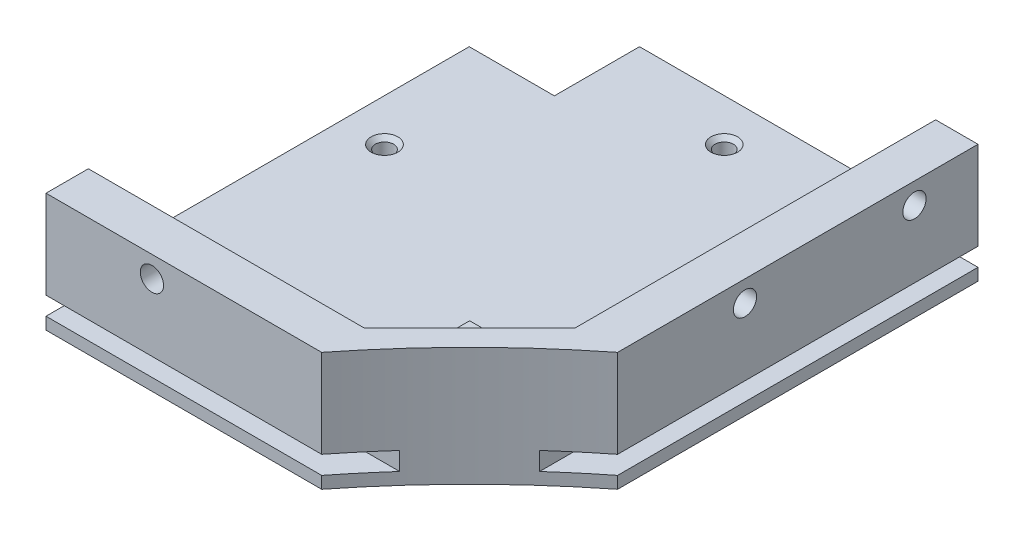
from build123d import *

# Parameters (mm, degrees)
SKETCH1_W                = 650
SKETCH1_H                = 650
BOSS_EXTRUDE1_DEPTH      = 8
BOSS_EXTRUDE2_DEPTH      = 650
CUT_EXTRUDE2_DEPTH       = 921.277302922
CUT_EXTRUDE2_DEPTH_BACK  = 921.277302922
SKETCH4_R                = 11
CUT_EXTRUDE1_DEPTH       = 920.932062709
CUT_EXTRUDE1_DEPTH_BACK  = 920.932062709
SKETCH2_R                = 210
CUT_EXTRUDE3_DEPTH       = 921.277302998
CUT_EXTRUDE3_DEPTH_BACK  = 110
CUT_EXTRUDE4_DEPTH       = 110
CUT_EXTRUDE5_DEPTH       = 920.932062713
CUT_EXTRUDE5_DEPTH_BACK  = 920.932062713
SKETCH7_OUTSIDE_W        = 836.056
SKETCH7_OUTSIDE_H        = 836.056
BOSS_EXTRUDE3_DEPTH      = 160.08
BOSS_EXTRUDE4_DEPTH      = 160.08
SKETCH21_W               = 10
SKETCH21_H               = 4.3
CUT_EXTRUDE10_DEPTH      = 680.197320372
SKETCH22_W               = 10
SKETCH22_H               = 4.3
CUT_EXTRUDE11_DEPTH      = 278.189465889
BOSS_EXTRUDE5_DEPTH      = 60
CUT_EXTRUDE6_DEPTH       = 679.914574891
CUT_EXTRUDE6_DEPTH_BACK  = 679.914574891
SKETCH12_R               = 210
CUT_EXTRUDE14_DEPTH      = 11
SKETCH27_R               = 2.2
SKETCH27_R_2             = 2.75
CUT_EXTRUDE15_DEPTH      = 11
SKETCH28_R               = 2.75
SKETCH28_R_2             = 2.2
CUT_EXTRUDE16_DEPTH      = 11
SKETCH29_W               = 20
SKETCH29_H               = 20
CUT_EXTRUDE17_DEPTH      = 10
CUT_EXTRUDE18_DEPTH      = 679.914574891
CUT_EXTRUDE18_DEPTH_BACK = 679.914574891
SKETCH30_W               = 95
SKETCH30_H               = 195
CUT_EXTRUDE19_DEPTH      = 679.914574891
CUT_EXTRUDE19_DEPTH_BACK = 679.914574891
SKETCH31_W               = 100
SKETCH31_H               = 75
SKETCH32_W               = 20.1
SKETCH32_H               = 20.1
CUT_EXTRUDE20_DEPTH      = 10
SKETCH33_R               = 2.15
CUT_EXTRUDE21_DEPTH      = 10
CHAMFER1_SIZE            = 1


with BuildPart() as part:
    # Sketch1 → Boss-Extrude1 (new body)
    with BuildSketch(Plane(origin=(0, 0, 0), x_dir=(1, 0, 0), z_dir=(0, 1, 0))):
        with Locations((325, 325)):
            Rectangle(SKETCH1_W, SKETCH1_H)
    extrude(amount=BOSS_EXTRUDE1_DEPTH)

    # Sketch3 → Boss-Extrude2 (add)
    with BuildSketch(Plane.XY):
        Polygon((300, 43.707142143), (350, 43.707142143), (385, 8), (265, 8), align=None)
    extrude(amount=-BOSS_EXTRUDE2_DEPTH)

    # Sketch4 → Cut-Extrude2 (cut, two sides: drawn at the far end of the back side and taken through both)
    with BuildSketch(Plane.XY.offset(-CUT_EXTRUDE2_DEPTH_BACK)):
        with Locations((325, 22)):
            Circle(SKETCH4_R)
    extrude(amount=CUT_EXTRUDE2_DEPTH + CUT_EXTRUDE2_DEPTH_BACK, mode=Mode.SUBTRACT)

    # Sketch2 → Cut-Extrude1 (cut, two sides: drawn at the far end of the back side and taken through both)
    with BuildSketch(Plane(origin=(0, 8, 0), x_dir=(1, 0, 0), z_dir=(0, 1, 0)).offset(-CUT_EXTRUDE1_DEPTH_BACK)):
        with Locations(Location((325, 325, 0), (0, 0, 270))):
            Circle(SKETCH2_R)
    extrude(amount=CUT_EXTRUDE1_DEPTH + CUT_EXTRUDE1_DEPTH_BACK, mode=Mode.SUBTRACT)

    # Sketch5 → Cut-Extrude3 (cut, two sides: drawn at the far end of the back side and taken through both)
    with BuildSketch(Plane.XY.offset(-CUT_EXTRUDE3_DEPTH_BACK)):
        Polygon((300, 43.707142143), (350, 43.707142143), (365.396078824, 28), (350, 28), (350, 8), (300, 8), (300, 28), (284.603921176, 28), align=None)
    extrude(amount=CUT_EXTRUDE3_DEPTH + CUT_EXTRUDE3_DEPTH_BACK, mode=Mode.SUBTRACT)

    # Sketch6 → Cut-Extrude4 (cut)
    with BuildSketch(Plane(origin=(0, 0, -650), x_dir=(-1, 0, 0), z_dir=(0, 0, -1))):
        Polygon((-350, 43.707142143), (-300, 43.707142143), (-284.603921176, 28), (-300, 28), (-300, 8), (-350, 8), (-350, 28), (-365.396078824, 28), align=None)
    extrude(amount=-CUT_EXTRUDE4_DEPTH, mode=Mode.SUBTRACT)

    # Sketch7 outside → Cut-Extrude5 (cut, two sides: drawn at the far end of the back side and taken through both)
    with BuildSketch(Plane(origin=(0, 8, 0), x_dir=(1, 0, 0), z_dir=(0, 1, 0)).offset(-CUT_EXTRUDE5_DEPTH_BACK)):
        with Locations((325, 325)):
            Rectangle(SKETCH7_OUTSIDE_W, SKETCH7_OUTSIDE_H)
        Polygon((195, 455), (195, 489.924225025), (195, 650), (167.478198198, 686.544504505), (-70.838918919, 686.544504505), (-70.838918919, 472.462112512), (0, 455), (160.075774975, 455), align=None, mode=Mode.SUBTRACT)
    extrude(amount=CUT_EXTRUDE5_DEPTH + CUT_EXTRUDE5_DEPTH_BACK, mode=Mode.SUBTRACT)

    # Sketch8 → Boss-Extrude3 (add)
    with BuildSketch(Plane(origin=(0, 0, -650), x_dir=(-1, 0, 0), z_dir=(0, 0, -1))):
        Polygon((-195, 8), (-195, 28), (-185, 28), (-185, 17), (-175, 8), align=None)
    extrude(amount=-BOSS_EXTRUDE3_DEPTH)

    # Sketch10 → Boss-Extrude4 (add)
    with BuildSketch(Plane.ZY):
        Polygon((-455, 8), (-455, 28), (-465, 28), (-465, 17), (-475, 8), align=None)
    extrude(amount=-BOSS_EXTRUDE4_DEPTH)

    # Sketch21 → Cut-Extrude10 (cut, through all)
    with BuildSketch(Plane.ZY):
        with Locations((-460, 5)):
            Rectangle(SKETCH21_W, SKETCH21_H)
    extrude(amount=-CUT_EXTRUDE10_DEPTH, mode=Mode.SUBTRACT)

    # Sketch22 → Cut-Extrude11 (cut, through all)
    with BuildSketch(Plane(origin=(0, 0, -650), x_dir=(-1, 0, 0), z_dir=(0, 0, -1))):
        with Locations((-190, 5)):
            Rectangle(SKETCH22_W, SKETCH22_H)
    extrude(amount=-CUT_EXTRUDE11_DEPTH, mode=Mode.SUBTRACT)

    # Sketch23 → Boss-Extrude5 (add)
    with BuildSketch(Plane.XY.offset(-489.92)):
        Polygon((194.99464011, 8), (195, 28), (160.08, 28), (160.08, 8), align=None)
    extrude(amount=BOSS_EXTRUDE5_DEPTH)

    # Sketch12 → Cut-Extrude6 (cut, two sides: drawn at the far end of the back side and taken through both)
    with BuildSketch(Plane(origin=(0, 8, 0), x_dir=(1, 0, 0), z_dir=(0, 1, 0)).offset(-CUT_EXTRUDE6_DEPTH_BACK)):
        with Locations((325, 325)):
            Circle(SKETCH12_R)
    extrude(amount=CUT_EXTRUDE6_DEPTH + CUT_EXTRUDE6_DEPTH_BACK, mode=Mode.SUBTRACT)

    # Sketch26 → Cut-Extrude14 (cut)
    with BuildSketch(Plane(origin=(0, 28, 0), x_dir=(1, 0, 0), z_dir=(0, 1, 0))):
        Polygon((185, 489.92), (160.08, 489.92), (160.08, 465), align=None)
    extrude(amount=-CUT_EXTRUDE14_DEPTH, mode=Mode.SUBTRACT)

    # Sketch27 → Cut-Extrude15 (cut)
    with BuildSketch(Plane.ZY.offset(-185)):
        with Locations((-610, 23)):
            Circle(SKETCH27_R)
        with Locations((-560, 23)):
            Circle(SKETCH27_R_2)
        with Locations((-520, 23)):
            Circle(SKETCH27_R_2)
    extrude(amount=-CUT_EXTRUDE15_DEPTH, mode=Mode.SUBTRACT)

    # Sketch28 → Cut-Extrude16 (cut)
    with BuildSketch(Plane(origin=(0, 0, -465), x_dir=(-1, 0, 0), z_dir=(0, 0, -1))):
        with Locations((-120, 23)):
            Circle(SKETCH28_R)
        with Locations((-80, 23)):
            Circle(SKETCH28_R_2)
        with Locations((-40, 23)):
            Circle(SKETCH28_R_2)
    extrude(amount=-CUT_EXTRUDE16_DEPTH, mode=Mode.SUBTRACT)

    # Sketch29 → Cut-Extrude17 (cut)
    with BuildSketch(Plane(origin=(0, 8, 0), x_dir=(1, 0, 0), z_dir=(0, 1, 0))):
        with Locations((10, 640)):
            Rectangle(SKETCH29_W, SKETCH29_H)
    extrude(amount=-CUT_EXTRUDE17_DEPTH, mode=Mode.SUBTRACT)

    # Sketch30 → Cut-Extrude18 (cut, two sides: drawn at the far end of the back side and taken through both)
    with BuildSketch(Plane(origin=(0, 8, 0), x_dir=(1, 0, 0), z_dir=(0, 1, 0)).offset(-CUT_EXTRUDE18_DEPTH_BACK)):
        with Locations((47.5, 552.5)):
            Rectangle(SKETCH30_W, SKETCH30_H)
    extrude(amount=CUT_EXTRUDE18_DEPTH + CUT_EXTRUDE18_DEPTH_BACK, mode=Mode.SUBTRACT)

    # Sketch31 → Cut-Extrude19 (cut, two sides: drawn at the far end of the back side and taken through both)
    with BuildSketch(Plane(origin=(0, 8, 0), x_dir=(1, 0, 0), z_dir=(0, 1, 0)).offset(-CUT_EXTRUDE19_DEPTH_BACK)):
        with Locations((145, 612.5)):
            Rectangle(SKETCH31_W, SKETCH31_H)
    extrude(amount=CUT_EXTRUDE19_DEPTH + CUT_EXTRUDE19_DEPTH_BACK, mode=Mode.SUBTRACT)

    # Sketch32 → Cut-Extrude20 (cut)
    with BuildSketch(Plane(origin=(0, 8, 0), x_dir=(1, 0, 0), z_dir=(0, 1, 0))):
        with Locations((105.05, 564.95)):
            Rectangle(SKETCH32_W, SKETCH32_H)
    extrude(amount=-CUT_EXTRUDE20_DEPTH, mode=Mode.SUBTRACT)

    # Sketch33 → Cut-Extrude21 (cut)
    with BuildSketch(Plane(origin=(0, 8, 0), x_dir=(1, 0, 0), z_dir=(0, 1, 0))):
        with Locations(Location((105, 524.9, 0), (0, 0, 270))):
            Circle(SKETCH33_R)
        with Locations(Location((145.1, 565, 0), (0, 0, 270))):
            Circle(SKETCH33_R)
    extrude(amount=-CUT_EXTRUDE21_DEPTH, mode=Mode.SUBTRACT)

    # Chamfer1
    chamfer1_edges = [part.edges().sort_by_distance(p)[0] for p in [
        (105, 8, -527.05),
        (145.1, 8, -567.15),
    ]]
    chamfer(chamfer1_edges, length=CHAMFER1_SIZE)


solid = part.part
